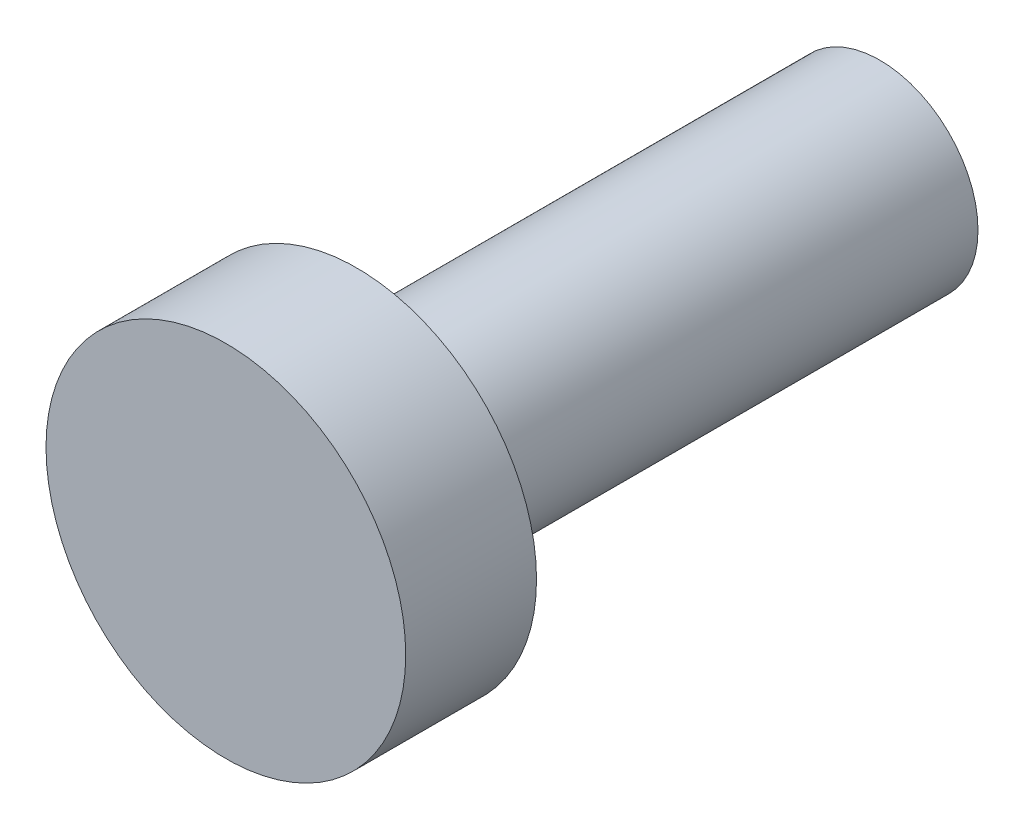
from build123d import *

# Parameters (mm, degrees)
SHANK_NOMINAL_THREAD_ENVELOPE_START     = -8
SHANK_NOMINAL_THREAD_ENVELOPE_PROFILE_R = 1.5
SHANK_NOMINAL_THREAD_ENVELOPE_DEPTH     = 8
HEAD_ENVELOPE_D5P5_H2P0_PROFILE_R       = 2.75
HEAD_ENVELOPE_D5P5_H2P0_DEPTH           = 2


with BuildPart() as part:
    # Shank_nominal_thread_envelope_profile → Shank_nominal_thread_envelope (new body)
    with BuildSketch(Plane.XY.offset(SHANK_NOMINAL_THREAD_ENVELOPE_START)):
        Circle(SHANK_NOMINAL_THREAD_ENVELOPE_PROFILE_R)
    extrude(amount=SHANK_NOMINAL_THREAD_ENVELOPE_DEPTH)

    # Head_envelope_D5p5_H2p0_profile → Head_envelope_D5p5_H2p0 (add)
    with BuildSketch(Plane.XY):
        Circle(HEAD_ENVELOPE_D5P5_H2P0_PROFILE_R)
    extrude(amount=HEAD_ENVELOPE_D5P5_H2P0_DEPTH)


solid = part.part
